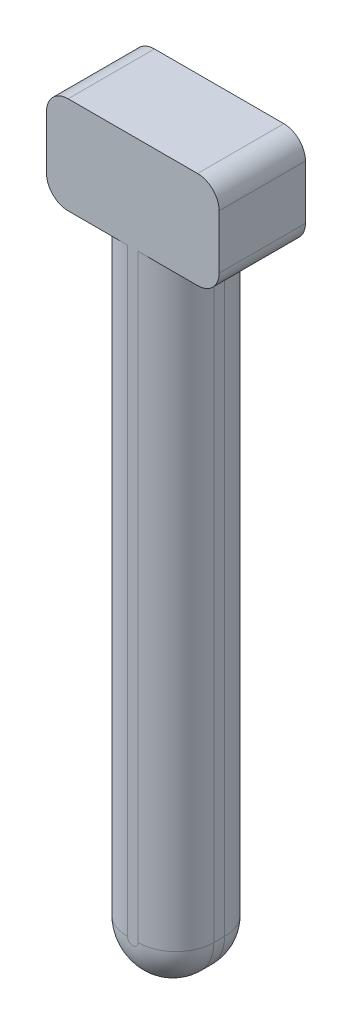
from build123d import *

# Parameters (mm, degrees)
BOSS_EXTRUDE1_DEPTH = 4
FILLET1_R           = 1.75
FILLET2_R           = 1


with BuildPart() as part:
    # Sketch1 → Boss-Extrude1 (new body)
    with BuildSketch(Plane.XY):
        with BuildLine():
            Line((2, -2.25), (-2, -2.25))
            Line((-2, -2.25), (-2, -30))
            ThreePointArc((-2, -30), (0, -32), (2, -30))
            Line((2, -30), (2, -2.25))
        make_face()
        with BuildLine():
            Line((-2, 0), (-2, -2.25))
            Line((-2, -2.25), (2, -2.25))
            Line((2, -2.25), (2, 0))
            ThreePointArc((2, 0), (0, 2), (-2, 0))
        make_face()
        with BuildLine():
            Line((-4, 2.25), (-4, -2.25))
            Line((-4, -2.25), (-2, -2.25))
            Line((-2, -2.25), (-2, 0))
            ThreePointArc((-2, 0), (0, 2), (2, 0))
            Line((2, 0), (2, -2.25))
            Line((2, -2.25), (4, -2.25))
            Line((4, -2.25), (4, 2.25))
            Line((4, 2.25), (-4, 2.25))
        make_face()
    extrude(amount=BOSS_EXTRUDE1_DEPTH)

    # Fillet1
    fillet1_edges = [part.edges().sort_by_distance(p)[0] for p in [
        (2, -16.125, 0),
        (0, -32, 0),
        (-2, -16.125, 0),
        (0, -32, 4),
        (2, -16.125, 4),
        (-2, -16.125, 4),
    ]]
    fillet(fillet1_edges, radius=FILLET1_R)

    # Fillet2
    fillet2_edges = [part.edges().sort_by_distance(p)[0] for p in [
        (-4, -2.25, 2),
        (-4, 2.25, 2),
        (4, 2.25, 2),
        (4, -2.25, 2),
    ]]
    fillet(fillet2_edges, radius=FILLET2_R)


solid = part.part
